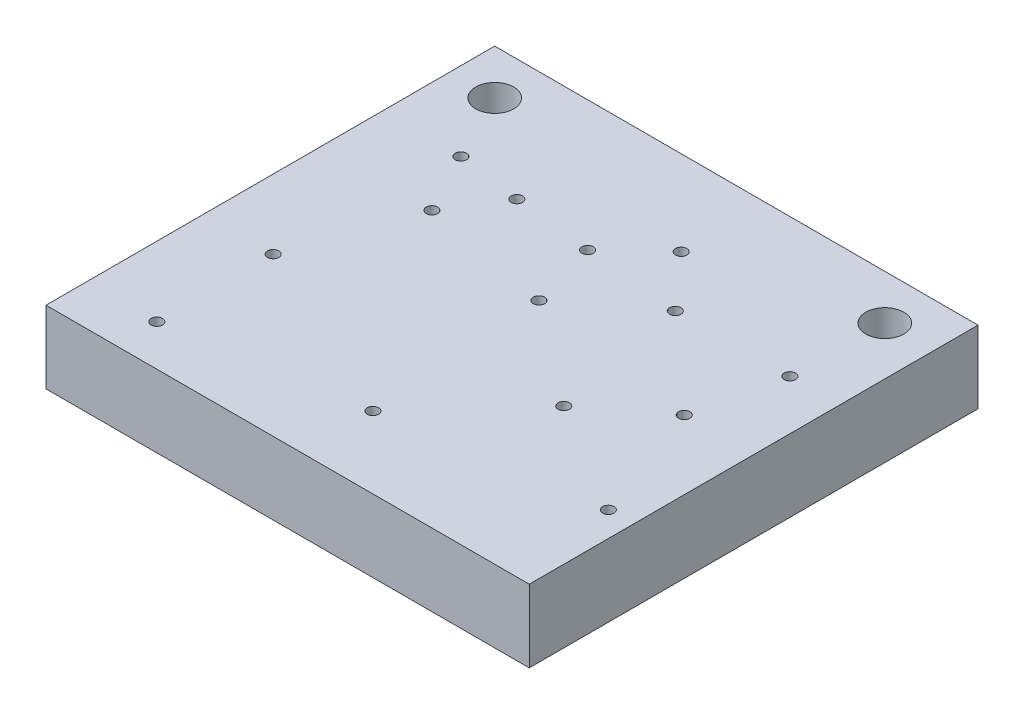
from build123d import *

# Parameters (mm, degrees)
SKETCH2_W           = 140
SKETCH2_H           = 130
SKETCH2_R           = 5.5
SKETCH2_R_2         = 1.65
BOSS_EXTRUDE1_DEPTH = 21


with BuildPart() as part:
    # Sketch2 → Boss-Extrude1 (new body)
    with BuildSketch(Plane(origin=(0, 0, 0), x_dir=(1, 0, 0), z_dir=(0, 1, 0))):
        with Locations((70, -65)):
            Rectangle(SKETCH2_W, SKETCH2_H)
        with Locations(Location((13, -13, 0), (0, 0, 90))):
            Circle(SKETCH2_R, mode=Mode.SUBTRACT)
        with Locations(Location((126, -13, 0), (0, 0, 90))):
            Circle(SKETCH2_R, mode=Mode.SUBTRACT)
        with Locations(Location((78.6, -24.6, 0), (0, 0, 90))):
            Circle(SKETCH2_R_2, mode=Mode.SUBTRACT)
        with Locations(Location((120, -65.1, 0), (0, 0, 90))):
            Circle(SKETCH2_R_2, mode=Mode.SUBTRACT)
        with Locations(Location((73.9, -109.2, 0), (0, 0, 90))):
            Circle(SKETCH2_R_2, mode=Mode.SUBTRACT)
        with Locations(Location((32.1, -50.3, 0), (0, 0, 90))):
            Circle(SKETCH2_R_2, mode=Mode.SUBTRACT)
        with Locations(Location((22.8, -32.6, 0), (0, 0, 90))):
            Circle(SKETCH2_R_2, mode=Mode.SUBTRACT)
        with Locations(Location((41.6, -35.2, 0), (0, 0, 90))):
            Circle(SKETCH2_R_2, mode=Mode.SUBTRACT)
        with Locations(Location((64.6, -37.7, 0), (0, 0, 90))):
            Circle(SKETCH2_R_2, mode=Mode.SUBTRACT)
        with Locations(Location((92.6, -40.3, 0), (0, 0, 90))):
            Circle(SKETCH2_R_2, mode=Mode.SUBTRACT)
        with Locations(Location((125.6, -40.1, 0), (0, 0, 90))):
            Circle(SKETCH2_R_2, mode=Mode.SUBTRACT)
        with Locations(Location((20.1, -84.3, 0), (0, 0, 90))):
            Circle(SKETCH2_R_2, mode=Mode.SUBTRACT)
        with Locations(Location((20.2, -118.1, 0), (0, 0, 90))):
            Circle(SKETCH2_R_2, mode=Mode.SUBTRACT)
        with Locations(Location((70.2, -57.4, 0), (0, 0, 90))):
            Circle(SKETCH2_R_2, mode=Mode.SUBTRACT)
        with Locations(Location((100.3, -80.3, 0), (0, 0, 90))):
            Circle(SKETCH2_R_2, mode=Mode.SUBTRACT)
        with Locations(Location((132.8, -99.9, 0), (0, 0, 90))):
            Circle(SKETCH2_R_2, mode=Mode.SUBTRACT)
    extrude(amount=BOSS_EXTRUDE1_DEPTH)


solid = part.part
